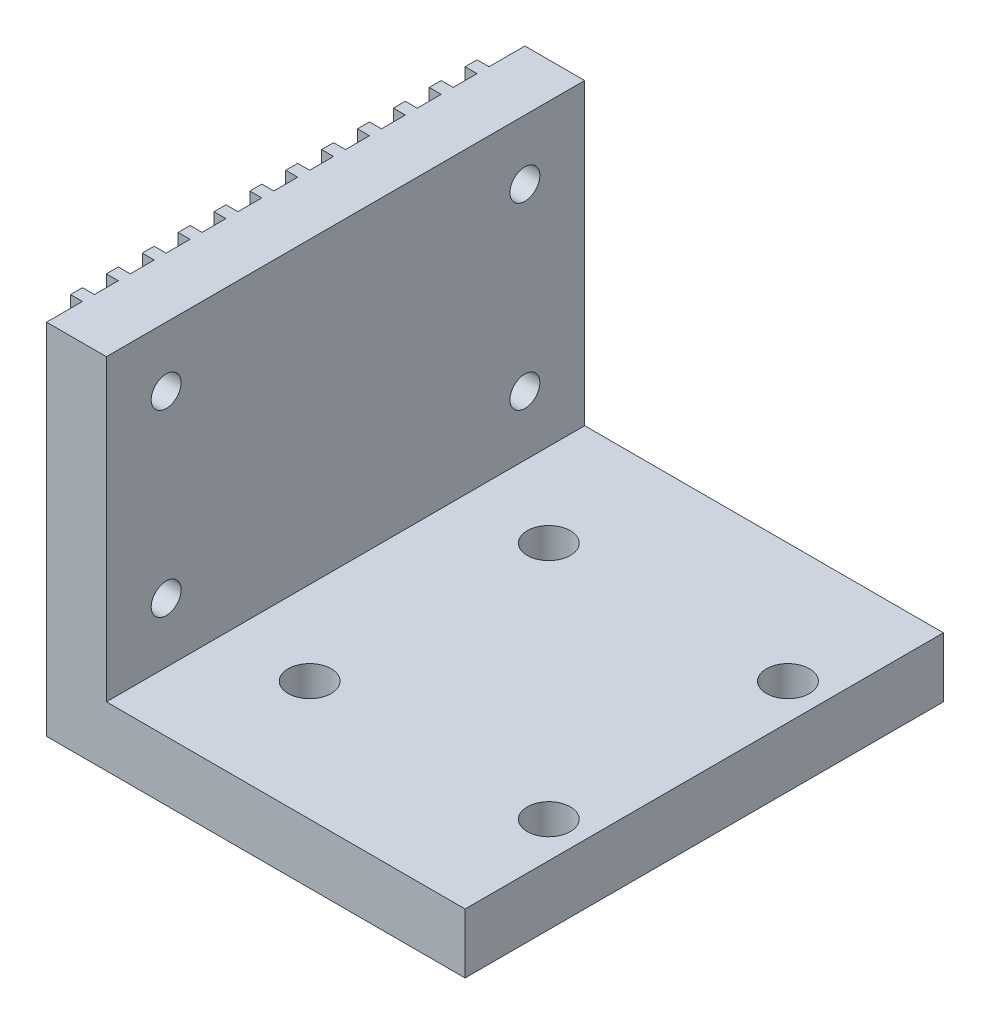
from build123d import *

# Parameters (mm, degrees)
BOSS_EXTRU_1_DEPTH                        = 40
ESQUISSE2_W                               = 1
ESQUISSE2_H                               = 30
EXTRU_MINCE2_DEPTH                        = 1
R_P_TITION_LIN_AIRE1_COUNT                = 12
R_P_TITION_LIN_AIRE1_PITCH                = 3
TROU_POUR_TARAUDAGE_POUR_TROU_TARAUD_M3_D = 2.5
D_GAGEMENT_M33_D                          = 3.6


with BuildPart() as part:
    # Esquisse1 → Boss.-Extru.1 (new body)
    with BuildSketch(Plane.XY):
        Polygon((-17.178456592, 11.666666667), (-17.178456592, -18.333333333), (17.821543408, -18.333333333), (17.821543408, -13.333333333), (-12.178456592, -13.333333333), (-12.178456592, 11.666666667), align=None)
    extrude(amount=BOSS_EXTRU_1_DEPTH)

    # Esquisse2 → Extru.-Mince2 (add)
    with BuildSketch(Plane.ZY.offset(17.178456592)):
        with Locations((36.5, -3.333333333)):
            Rectangle(ESQUISSE2_W, ESQUISSE2_H)
    extru_mince2 = extrude(amount=EXTRU_MINCE2_DEPTH)

    # Répétition linéaire1: Extru.-Mince2 ×12
    with Locations(*[(0, 0, -i * R_P_TITION_LIN_AIRE1_PITCH) for i in range(1, R_P_TITION_LIN_AIRE1_COUNT)]):
        add(extru_mince2)

    # Trou pour taraudage pour trou taraudé M34 (through all)
    with Locations(Plane(origin=(-12.178456592, 0, 0), x_dir=(0, 0, -1), z_dir=(1, 0, 0))):
        with Locations((-5, 6.666666667), (-35, 6.666666667), (-35, -8.333333333), (-5, -8.333333333)):
            Hole(TROU_POUR_TARAUDAGE_POUR_TROU_TARAUD_M3_D / 2)

    # Dégagement M33 (through all)
    with Locations(Plane(origin=(0, -13.333333333, 0), x_dir=(1, 0, 0), z_dir=(0, 1, 0))):
        with Locations((14.821543408, -10), (14.821543408, -30), (-5.178456592, -10), (-5.178456592, -30)):
            Hole(D_GAGEMENT_M33_D / 2)


solid = part.part
